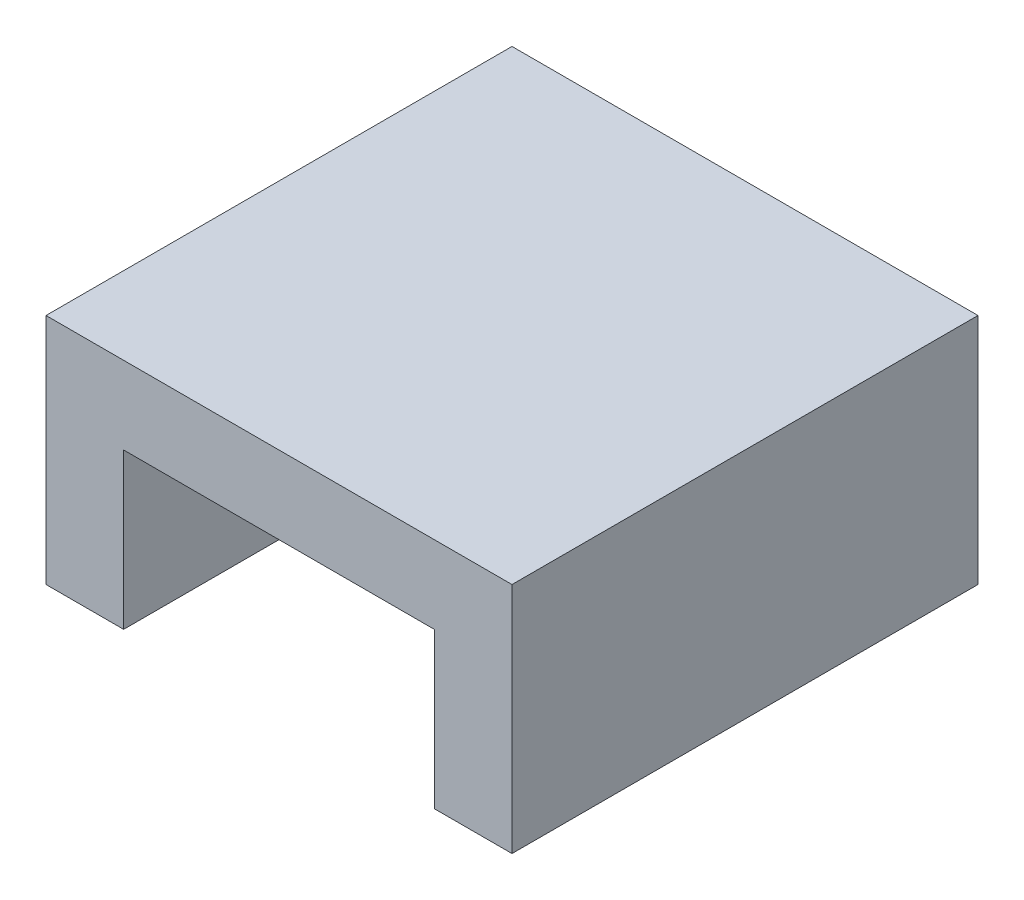
from build123d import *

# Parameters (mm, degrees)
BOSS_EXTRUDE1_DEPTH = 38.1


with BuildPart() as part:
    # Sketch1 → Boss-Extrude1 (new body)
    with BuildSketch(Plane.XY):
        Polygon((-12.7, 0), (-12.7, 12.7), (12.7, 12.7), (12.7, 0), (19.05, 0), (19.05, 19.05), (-19.05, 19.05), (-19.05, 0), align=None)
    extrude(amount=BOSS_EXTRUDE1_DEPTH)


solid = part.part
